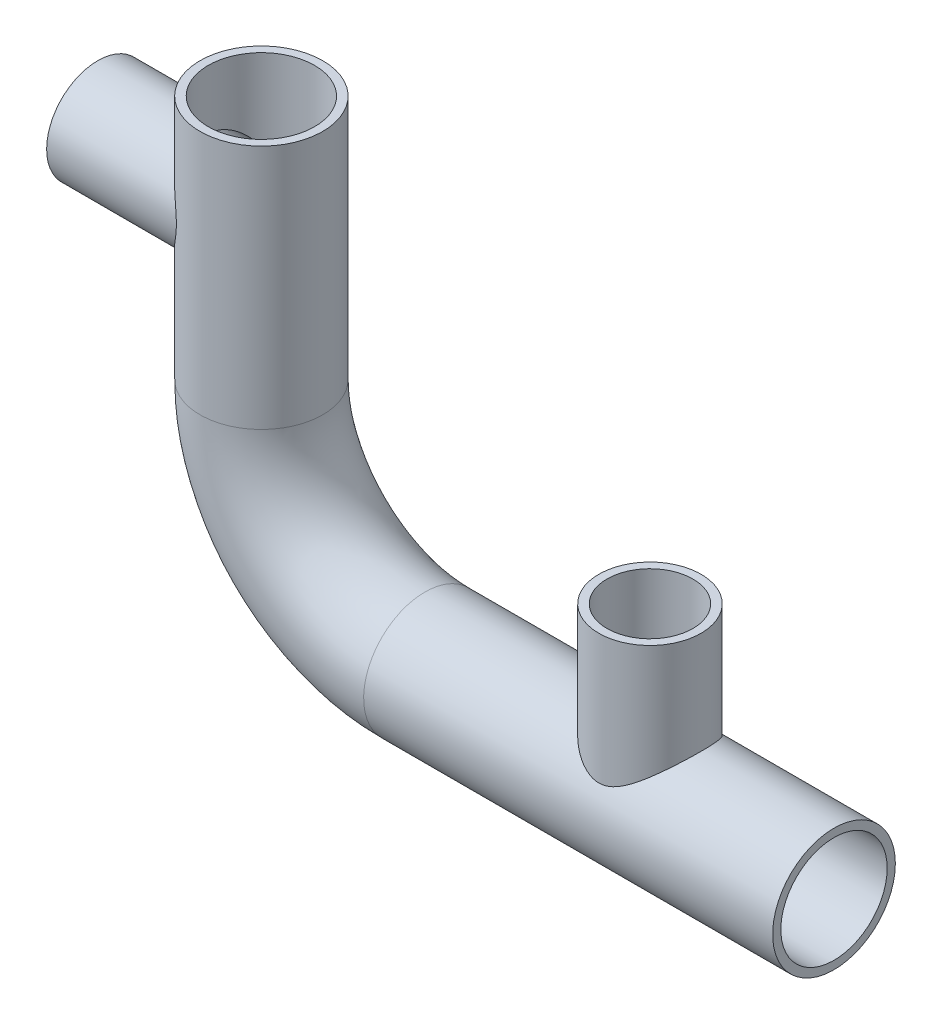
from build123d import *

# Parameters (mm, degrees)
SKETCH_2_R           = 15
EXTRUDE_1_REACH      = 155.052
EXTRUDE_1_END_RADIUS = 15
SKETCH_3_R           = 12.5
EXTRUDE_2_REACH      = 208.458
EXTRUDE_2_END_RADIUS = 15
SKETCH_4_R           = 12.5
SHELL_1_T            = -2


with BuildPart() as part:
    # 스윕1: sweep along a path in 스케치1
    with BuildLine(Plane.XY) as sweep_1_path:
        Line((0, 100), (0, 40))
        ThreePointArc((0, 40), (11.715728753, 11.715728753), (40, 0))
        Line((40, 0), (140, 0))
    # 스케치2 → 스윕1 (sweep)
    with BuildSketch(Plane(origin=(140, 0, 0), x_dir=(0, 0, -1), z_dir=(1, 0, 0))):
        Circle(SKETCH_2_R)
    sweep(path=sweep_1_path.line)

    # 보스-돌출1: up to this cylinder (the profile starts outside it)
    extrude_1_end = Plane(origin=(95, 0, 0), z_dir=(1, 0, 0)) * Cylinder(EXTRUDE_1_END_RADIUS, 341.104, mode=Mode.PRIVATE)
    # 스케치3 → 보스-돌출1 (add, up to the surface)
    with BuildSketch(Plane(origin=(0, 40, 0), x_dir=(1, 0, 0), z_dir=(0, 1, 0)), mode=Mode.PRIVATE) as extrude_1_sk1:
        with Locations(Location((95, 0, 0), (0, 0, 270))):
            Circle(SKETCH_3_R)
    extrude_1_tool1 = extrude(extrude_1_sk1.sketch, amount=-EXTRUDE_1_REACH, mode=Mode.PRIVATE) - extrude_1_end
    add(extrude_1_tool1.solids().sort_by_distance((95, 40, 0))[0])

    # 보스-돌출2: up to this cylinder (the profile starts outside it)
    extrude_2_end = Plane(origin=(0, 75, 0), z_dir=(0, -1, 0)) * Cylinder(EXTRUDE_2_END_RADIUS, 447.916, mode=Mode.PRIVATE)
    # 스케치4 → 보스-돌출2 (add, up to the surface)
    with BuildSketch(Plane(origin=(-40, 0, 0), x_dir=(0, 0, -1), z_dir=(1, 0, 0)), mode=Mode.PRIVATE) as extrude_2_sk1:
        with Locations(Location((0, 75, 0), (0, 0, 180))):
            Circle(SKETCH_4_R)
    extrude_2_tool1 = extrude(extrude_2_sk1.sketch, amount=EXTRUDE_2_REACH, mode=Mode.PRIVATE) - extrude_2_end
    add(extrude_2_tool1.solids().sort_by_distance((-40, 75, 0))[0])

    # 쉘1
    shell_1_openings = [part.faces().sort_by_distance(p)[0] for p in [
        (95, 40, 0),
        (-40, 75, 0),
        (140, 0, 0),
        (0, 100, 0),
    ]]
    offset(amount=SHELL_1_T, openings=shell_1_openings, kind=Kind.INTERSECTION)


solid = part.part
